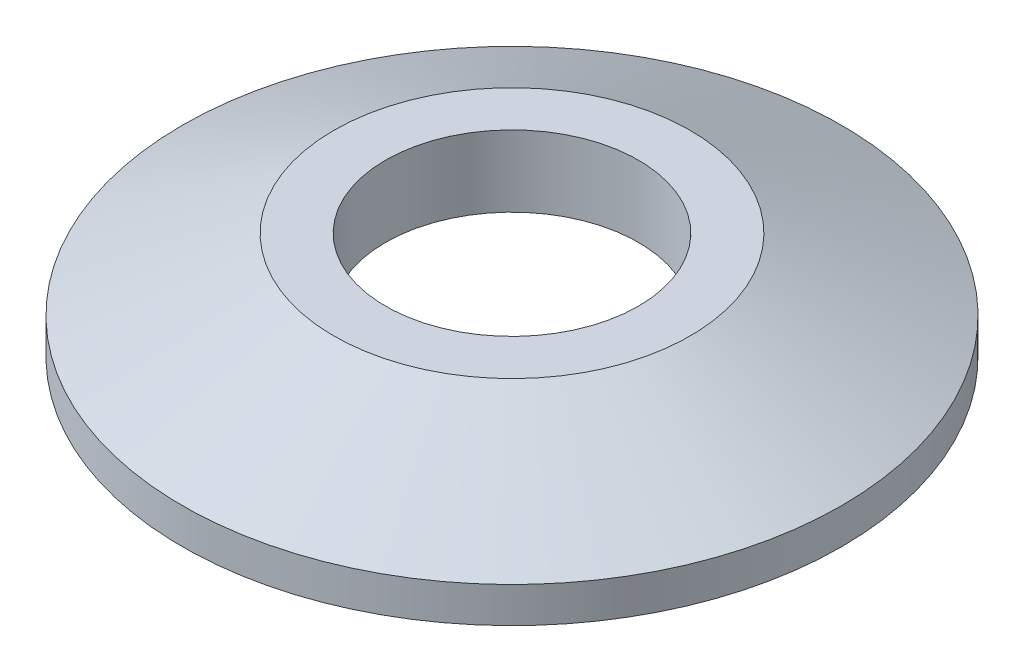
from build123d import *


with BuildPart() as part:
    # Sketch1 → Revolve1 (revolve)
    with BuildSketch(Plane.XY):
        Polygon((-18.5, 0), (-18.5, 2), (-10, 6), (-7.1, 6), (-7.1, 2), (-10, 2), (-10, 0), align=None)
    revolve(axis=Axis((0, 22.267562404, 0), (0, -1, 0)))


solid = part.part
